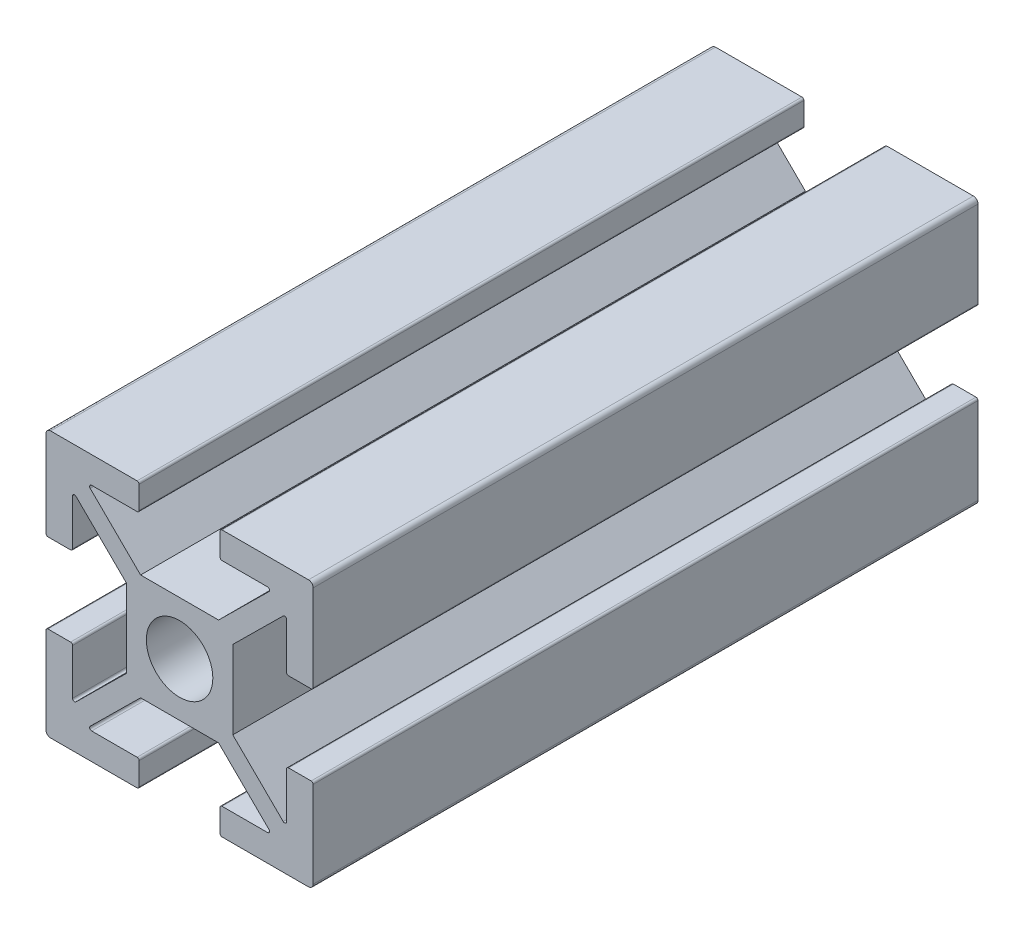
from build123d import *

# Parameters (mm, degrees)
SKETCH1_R           = 2.5
BOSS_EXTRUDE1_DEPTH = 50


with BuildPart() as part:
    # Sketch1 → Boss-Extrude1 (new body)
    with BuildSketch(Plane.XY):
        with BuildLine():
            Line((-31.376404226, -0.06181021), (-29.676404226, -0.06181021))
            ThreePointArc((-29.676404226, -0.06181021), (-29.570338208, -0.017876227), (-29.526404226, 0.08818979))
            Line((-29.526404226, 0.08818979), (-29.526404226, 3.524374304))
            ThreePointArc((-29.526404226, 3.524374304), (-29.43420518, 3.662790523), (-29.27095023, 3.631048831))
            Line((-29.27095023, 3.631048831), (-25.480107929, -0.116419988))
            Line((-25.480107929, -0.116419988), (-25.480107929, -6.007200432))
            Line((-25.480107929, -6.007200432), (-29.27095023, -9.754669251))
            ThreePointArc((-29.27095023, -9.754669251), (-29.43420518, -9.786410942), (-29.526404226, -9.647994723))
            Line((-29.526404226, -9.647994723), (-29.526404226, -6.21181021))
            ThreePointArc((-29.526404226, -6.21181021), (-29.570338208, -6.105744193), (-29.676404226, -6.06181021))
            Line((-29.676404226, -6.06181021), (-31.376404226, -6.06181021))
            ThreePointArc((-31.376404226, -6.06181021), (-31.482470243, -6.105744193), (-31.526404226, -6.21181021))
            Line((-31.526404226, -6.21181021), (-31.526404226, -12.71181021))
            ThreePointArc((-31.526404226, -12.71181021), (-31.423891599, -12.959297583), (-31.176404226, -13.06181021))
            Line((-31.176404226, -13.06181021), (-24.676404226, -13.06181021))
            ThreePointArc((-24.676404226, -13.06181021), (-24.570338208, -13.017876227), (-24.526404226, -12.91181021))
            Line((-24.526404226, -12.91181021), (-24.526404226, -11.21181021))
            ThreePointArc((-24.526404226, -11.21181021), (-24.570338208, -11.105744193), (-24.676404226, -11.06181021))
            Line((-24.676404226, -11.06181021), (-28.094489023, -11.06181021))
            ThreePointArc((-28.094489023, -11.06181021), (-28.233235517, -10.96881381), (-28.199943018, -10.805135682))
            Line((-28.199943018, -10.805135682), (-24.41329202, -7.06181021))
            Line((-24.41329202, -7.06181021), (-18.546923839, -7.06181021))
            Line((-18.546923839, -7.06181021), (-14.760272841, -10.805135682))
            ThreePointArc((-14.760272841, -10.805135682), (-14.726980342, -10.96881381), (-14.865726836, -11.06181021))
            Line((-14.865726836, -11.06181021), (-18.283811633, -11.06181021))
            ThreePointArc((-18.283811633, -11.06181021), (-18.38987765, -11.105744193), (-18.433811633, -11.21181021))
            Line((-18.433811633, -11.21181021), (-18.433811633, -12.91181021))
            ThreePointArc((-18.433811633, -12.91181021), (-18.38987765, -13.017876227), (-18.283811633, -13.06181021))
            Line((-18.283811633, -13.06181021), (-11.783811633, -13.06181021))
            ThreePointArc((-11.783811633, -13.06181021), (-11.53632426, -12.959297583), (-11.433811633, -12.71181021))
            Line((-11.433811633, -12.71181021), (-11.433811633, -6.21181021))
            ThreePointArc((-11.433811633, -6.21181021), (-11.477745616, -6.105744193), (-11.583811633, -6.06181021))
            Line((-11.583811633, -6.06181021), (-13.283811633, -6.06181021))
            ThreePointArc((-13.283811633, -6.06181021), (-13.38987765, -6.105744193), (-13.433811633, -6.21181021))
            Line((-13.433811633, -6.21181021), (-13.433811633, -9.647994723))
            ThreePointArc((-13.433811633, -9.647994723), (-13.526010678, -9.786410942), (-13.689265628, -9.754669251))
            Line((-13.689265628, -9.754669251), (-17.480107929, -6.007200432))
            Line((-17.480107929, -6.007200432), (-17.480107929, -0.116419988))
            Line((-17.480107929, -0.116419988), (-13.689265628, 3.631048831))
            ThreePointArc((-13.689265628, 3.631048831), (-13.526010678, 3.662790523), (-13.433811633, 3.524374304))
            Line((-13.433811633, 3.524374304), (-13.433811633, 0.08818979))
            ThreePointArc((-13.433811633, 0.08818979), (-13.38987765, -0.017876227), (-13.283811633, -0.06181021))
            Line((-13.283811633, -0.06181021), (-11.583811633, -0.06181021))
            ThreePointArc((-11.583811633, -0.06181021), (-11.477745616, -0.017876227), (-11.433811633, 0.08818979))
            Line((-11.433811633, 0.08818979), (-11.433811633, 6.58818979))
            ThreePointArc((-11.433811633, 6.58818979), (-11.53632426, 6.835677164), (-11.783811633, 6.93818979))
            Line((-11.783811633, 6.93818979), (-18.283811633, 6.93818979))
            ThreePointArc((-18.283811633, 6.93818979), (-18.38987765, 6.894255807), (-18.433811633, 6.78818979))
            Line((-18.433811633, 6.78818979), (-18.433811633, 5.08818979))
            ThreePointArc((-18.433811633, 5.08818979), (-18.38987765, 4.982123773), (-18.283811633, 4.93818979))
            Line((-18.283811633, 4.93818979), (-14.865726836, 4.93818979))
            ThreePointArc((-14.865726836, 4.93818979), (-14.726980342, 4.84519339), (-14.760272841, 4.681515262))
            Line((-14.760272841, 4.681515262), (-18.546923839, 0.93818979))
            Line((-18.546923839, 0.93818979), (-24.41329202, 0.93818979))
            Line((-24.41329202, 0.93818979), (-28.199943018, 4.681515262))
            ThreePointArc((-28.199943018, 4.681515262), (-28.233235517, 4.84519339), (-28.094489023, 4.93818979))
            Line((-28.094489023, 4.93818979), (-24.676404226, 4.93818979))
            ThreePointArc((-24.676404226, 4.93818979), (-24.570338208, 4.982123773), (-24.526404226, 5.08818979))
            Line((-24.526404226, 5.08818979), (-24.526404226, 6.78818979))
            ThreePointArc((-24.526404226, 6.78818979), (-24.570338208, 6.894255807), (-24.676404226, 6.93818979))
            Line((-24.676404226, 6.93818979), (-31.176404226, 6.93818979))
            ThreePointArc((-31.176404226, 6.93818979), (-31.423891599, 6.835677164), (-31.526404226, 6.58818979))
            Line((-31.526404226, 6.58818979), (-31.526404226, 0.08818979))
            ThreePointArc((-31.526404226, 0.08818979), (-31.482470243, -0.017876227), (-31.376404226, -0.06181021))
        make_face()
        with Locations((-21.480107929, -3.06181021)):
            Circle(SKETCH1_R, mode=Mode.SUBTRACT)
    extrude(amount=BOSS_EXTRUDE1_DEPTH)


solid = part.part
